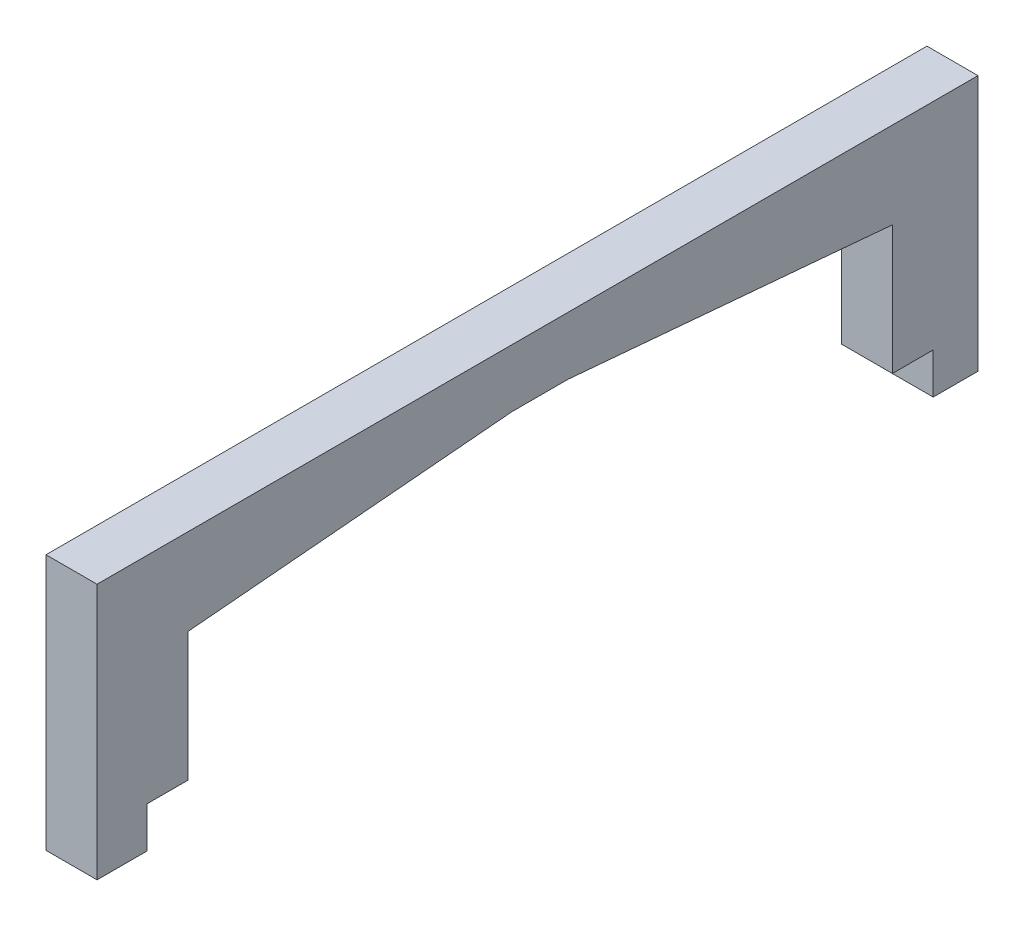
from build123d import *

# Parameters (mm, degrees)
RESSALTO_EXTRUS_O2_DEPTH = 10


with BuildPart() as part:
    # Esboço2 → Ressalto-extrusão2 (new body)
    with BuildSketch(Plane(origin=(0, 0, 0), x_dir=(0, 0, -1), z_dir=(1, 0, 0))):
        Polygon((-76.5, -37.173036245), (-86.271390261, -37.173036245), (-86.271390261, 12.975916329), (86.271390261, 12.975916329), (86.271390261, -37.173036245), (77.5, -37.173036245), (77.5, -29.169859635), (69.5, -29.169859635), (69.5, -3.948025217), (5.978169529, 1.609414836), (0, 1.609414836), (-4.978169529, 1.609414836), (-68.5, -3.948025217), (-68.5, -29.169859635), (-76.5, -29.169859635), align=None)
    extrude(amount=RESSALTO_EXTRUS_O2_DEPTH)


solid = part.part
